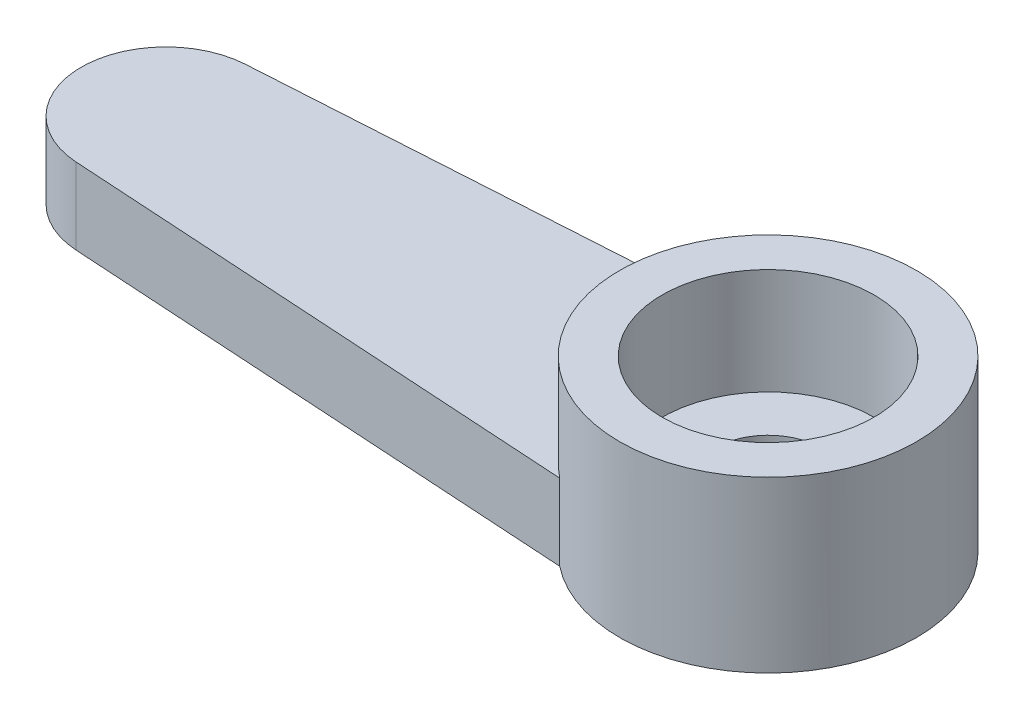
from build123d import *

# Parameters (mm, degrees)
SKETCH1_R           = 3.5
SKETCH1_R_2         = 2.5
BOSS_EXTRUDE1_DEPTH = 4
BOSS_EXTRUDE2_DEPTH = 1.8
SKETCH3_R           = 2.5
SKETCH3_R_2         = 1.25
BOSS_EXTRUDE3_DEPTH = 1.5


with BuildPart() as part:
    # Sketch1 → Boss-Extrude1 (new body)
    with BuildSketch(Plane(origin=(0, 0, 0), x_dir=(1, 0, 0), z_dir=(0, 1, 0))):
        with Locations(Location((0, 0, 0), (0, 0, 270))):
            Circle(SKETCH1_R)
        with Locations(Location((0, 0, 0), (0, 0, 270))):
            Circle(SKETCH1_R_2, mode=Mode.SUBTRACT)
    extrude(amount=BOSS_EXTRUDE1_DEPTH)

    # Sketch2 → Boss-Extrude2 (add)
    with BuildSketch(Plane(origin=(0, 0, 0), x_dir=(1, 0, 0), z_dir=(0, 1, 0))):
        with BuildLine():
            Line((-2.165063509, 2.75), (-14.323761314, 1.996167112))
            ThreePointArc((-14.323761314, 1.996167112), (-16.2, 0), (-14.323761314, -1.996167112))
            Line((-14.323761314, -1.996167112), (-2.165063509, -2.75))
            ThreePointArc((-2.165063509, -2.75), (-3.5, 0), (-2.165063509, 2.75))
        make_face()
    extrude(amount=BOSS_EXTRUDE2_DEPTH)

    # Sketch3 → Boss-Extrude3 (add)
    with BuildSketch(Plane(origin=(0, 0, 0), x_dir=(1, 0, 0), z_dir=(0, 1, 0))):
        with Locations(Location((0, 0, 0), (0, 0, 270))):
            Circle(SKETCH3_R)
        with Locations(Location((0, 0, 0), (0, 0, 270))):
            Circle(SKETCH3_R_2, mode=Mode.SUBTRACT)
    extrude(amount=BOSS_EXTRUDE3_DEPTH)


solid = part.part
